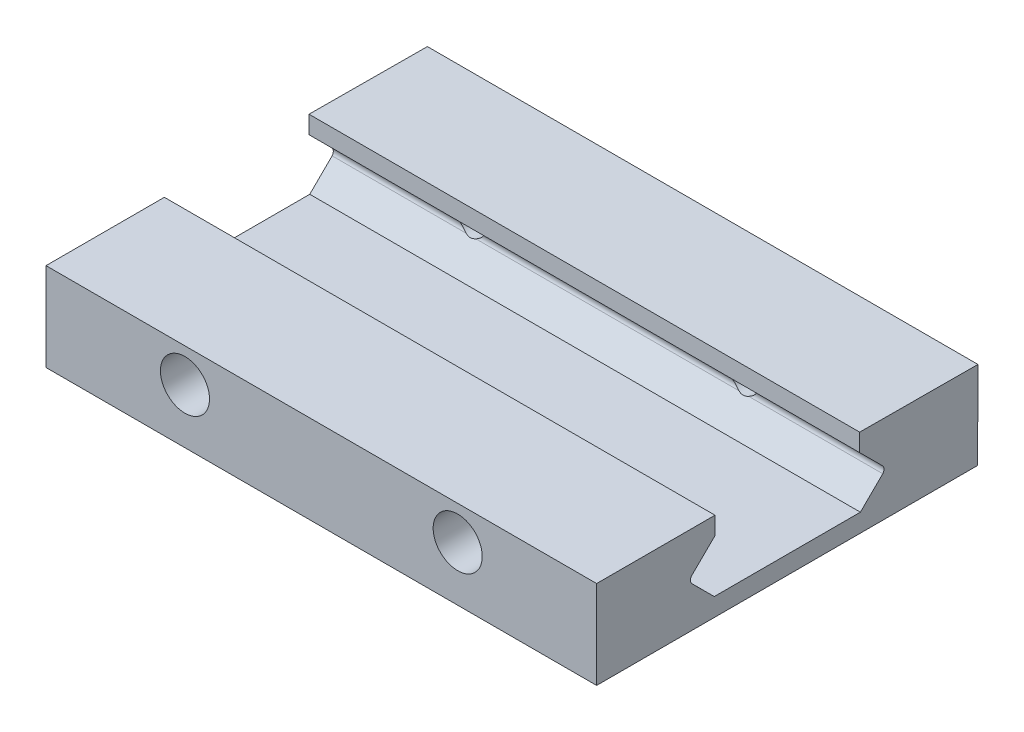
from build123d import *

# Parameters (mm, degrees)
SKETCH1_W           = 60.566280351
SKETCH1_H           = 41.91
BOSS_EXTRUDE1_DEPTH = 2
BOSS_EXTRUDE2_DEPTH = 60.56628035
CUT_EXTRUDE1_REACH  = 54.849
SKETCH5_R           = 1.5
SKETCH6_R           = 2.7
CUT_EXTRUDE2_DEPTH  = 4.1
SKETCH9_R           = 2.7
CUT_EXTRUDE3_DEPTH  = 4.1


with BuildPart() as part:
    # Sketch1 → Boss-Extrude1 (new body)
    with BuildSketch(Plane(origin=(0, 0, 0), x_dir=(1, 0, 0), z_dir=(0, 1, 0))):
        with Locations((0.392342893, 1.258772873)):
            Rectangle(SKETCH1_W, SKETCH1_H)
    extrude(amount=BOSS_EXTRUDE1_DEPTH)

    # Sketch4 → Boss-Extrude2 (add)
    with BuildSketch(Plane.ZY.offset(29.890797283)):
        with BuildLine():
            Line((-22.21383483, 1.959789744), (-9.274266868, 1.959789744))
            Line((-9.274266868, 1.959789744), (-11.775730551, 4.430225514))
            ThreePointArc((-11.775730551, 4.430225514), (-11.903861669, 4.791947782), (-11.793775933, 5.15956404))
            Line((-11.793775933, 5.15956404), (-9.222914706, 7.723241684))
            Line((-9.222914706, 7.723241684), (-9.232672854, 9.668426415))
            Line((-9.232672854, 9.668426415), (-22.252178068, 9.603113205))
            Line((-22.252178068, 9.603113205), (-22.21383483, 1.959789744))
        make_face()
        with BuildLine():
            Line((6.756821981, 2), (19.696227127, 2))
            Line((19.696227127, 2), (19.696227127, 9.708331019))
            Line((19.696227127, 9.708331019), (6.676558091, 9.708331019))
            Line((6.676558091, 9.708331019), (6.676558091, 7.763121812))
            Line((6.676558091, 7.763121812), (9.260247666, 5.212373159))
            ThreePointArc((9.260247666, 5.212373159), (9.372176165, 4.845313772), (9.24586124, 4.482953285))
            Line((9.24586124, 4.482953285), (6.756821981, 2))
        make_face()
    extrude(amount=-BOSS_EXTRUDE2_DEPTH)

    # Cut-Extrude1: up to this plane
    cut_extrude1_end = Plane(origin=(-29.890797283, 2, 19.696227127), z_dir=(0, 0, -1))
    # Sketch5 → Cut-Extrude1 (cut, up to the surface)
    with BuildSketch(Plane(origin=(0, -0.111385049, -22.203444644), x_dir=(-1, 0, 0), z_dir=(0, -0.005016503049651579, -0.9999874172694139)), mode=Mode.PRIVATE) as cut_extrude1_sk1:
        with Locations(Location((14.607657107, 5.892910673, 0), (0, 0, 331.006868197))):
            Circle(SKETCH5_R)
    cut_extrude1_tool1 = split(extrude(cut_extrude1_sk1.sketch, amount=-CUT_EXTRUDE1_REACH, mode=Mode.PRIVATE), bisect_by=cut_extrude1_end, keep=Keep.BOTH, mode=Mode.PRIVATE)
    add(cut_extrude1_tool1.solids().sort_by_distance((-14.607657, 5.781451, -22.233006))[0], mode=Mode.SUBTRACT)
    # Sketch5 → Cut-Extrude1 (cut, up to the surface)
    with BuildSketch(Plane(origin=(0, -0.111385049, -22.203444644), x_dir=(-1, 0, 0), z_dir=(0, -0.005016503049651579, -0.9999874172694139)), mode=Mode.PRIVATE) as cut_extrude1_sk2:
        with Locations(Location((-15.392342893, 5.892910673, 0), (0, 0, 331.006868197))):
            Circle(SKETCH5_R)
    cut_extrude1_tool2 = split(extrude(cut_extrude1_sk2.sketch, amount=-CUT_EXTRUDE1_REACH, mode=Mode.PRIVATE), bisect_by=cut_extrude1_end, keep=Keep.BOTH, mode=Mode.PRIVATE)
    add(cut_extrude1_tool2.solids().sort_by_distance((15.392343, 5.781451, -22.233006))[0], mode=Mode.SUBTRACT)

    # Sketch6 → Cut-Extrude2 (cut)
    with BuildSketch(Plane(origin=(0, -0.111385049, -22.203444644), x_dir=(-1, 0, 0), z_dir=(0, -0.005016503049651579, -0.9999874172694139))):
        with Locations(Location((14.607657107, 5.892910673, 0), (0, 0, 90))):
            Circle(SKETCH6_R)
        with Locations(Location((-15.392342893, 5.892910673, 0), (0, 0, 90))):
            Circle(SKETCH6_R)
    extrude(amount=-CUT_EXTRUDE2_DEPTH, mode=Mode.SUBTRACT)

    # Sketch9 → Cut-Extrude3 (cut)
    with BuildSketch(Plane.XY.offset(19.696227127)):
        with Locations((15.392342893, 5.991792249)):
            Circle(SKETCH9_R)
        with Locations((-14.607657107, 5.991792249)):
            Circle(SKETCH9_R)
    extrude(amount=-CUT_EXTRUDE3_DEPTH, mode=Mode.SUBTRACT)


solid = part.part
